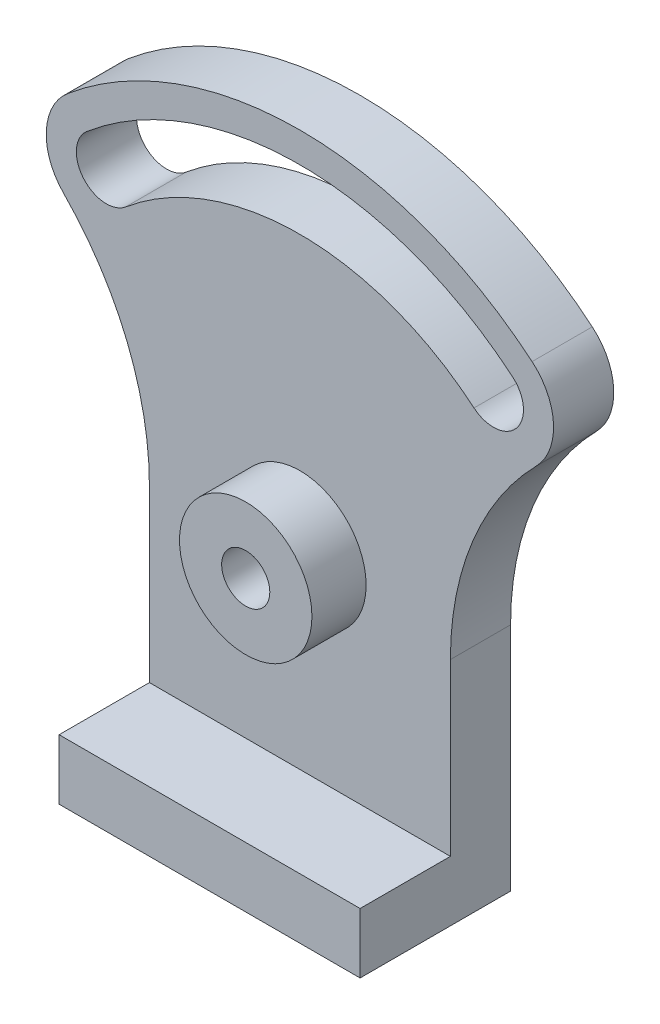
from build123d import *

# Parameters (mm, degrees)
SKETCH1_R           = 11
BOSS_EXTRUDE1_DEPTH = 10
SKETCH1_3_W         = 50
SKETCH1_3_H         = 10
BOSS_EXTRUDE2_DEPTH = 25
SKETCH1_4_R         = 11
SKETCH1_4_R_2       = 4
BOSS_EXTRUDE3_DEPTH = 19


with BuildPart() as part:
    # Sketch1 → Boss-Extrude1 (new body)
    with BuildSketch(Plane.XY):
        with BuildLine():
            Line((-25, -3.685481934), (-25, -32))
            Line((-25, -32), (25, -32))
            Line((25, -32), (25, -3.685481934))
            ThreePointArc((25, -3.685481934), (28.70821268, 15.210825292), (39.28281707, 31.304271474))
            ThreePointArc((39.28281707, 31.304271474), (42.127486852, 38.789799017), (38.567256581, 45.962666587))
            ThreePointArc((38.567256581, 45.962666587), (0, 60), (-38.567256581, 45.962666587))
            ThreePointArc((-38.567256581, 45.962666587), (-42.127486852, 38.789799017), (-39.28281707, 31.304271474))
            ThreePointArc((-39.28281707, 31.304271474), (-28.70821268, 15.210825292), (-25, -3.685481934))
        make_face()
        Circle(SKETCH1_R, mode=Mode.SUBTRACT)
        with BuildLine():
            ThreePointArc((-28.925442436, 34.47199994), (-35.9696027, 35.088284108), (-35.353318533, 42.132444372))
            ThreePointArc((-35.353318533, 42.132444372), (0, 55), (35.353318533, 42.132444372))
            ThreePointArc((35.353318533, 42.132444372), (35.9696027, 35.088284108), (28.925442436, 34.47199994))
            ThreePointArc((28.925442436, 34.47199994), (0, 45), (-28.925442436, 34.47199994))
        make_face(mode=Mode.SUBTRACT)
    extrude(amount=BOSS_EXTRUDE1_DEPTH)

    # Sketch1<3> → Boss-Extrude2 (add)
    with BuildSketch(Plane.XY):
        with Locations((0, -37)):
            Rectangle(SKETCH1_3_W, SKETCH1_3_H)
    extrude(amount=BOSS_EXTRUDE2_DEPTH)

    # Sketch1<4> → Boss-Extrude3 (add)
    with BuildSketch(Plane.XY):
        Circle(SKETCH1_4_R)
        Circle(SKETCH1_4_R_2, mode=Mode.SUBTRACT)
    extrude(amount=BOSS_EXTRUDE3_DEPTH)


solid = part.part
